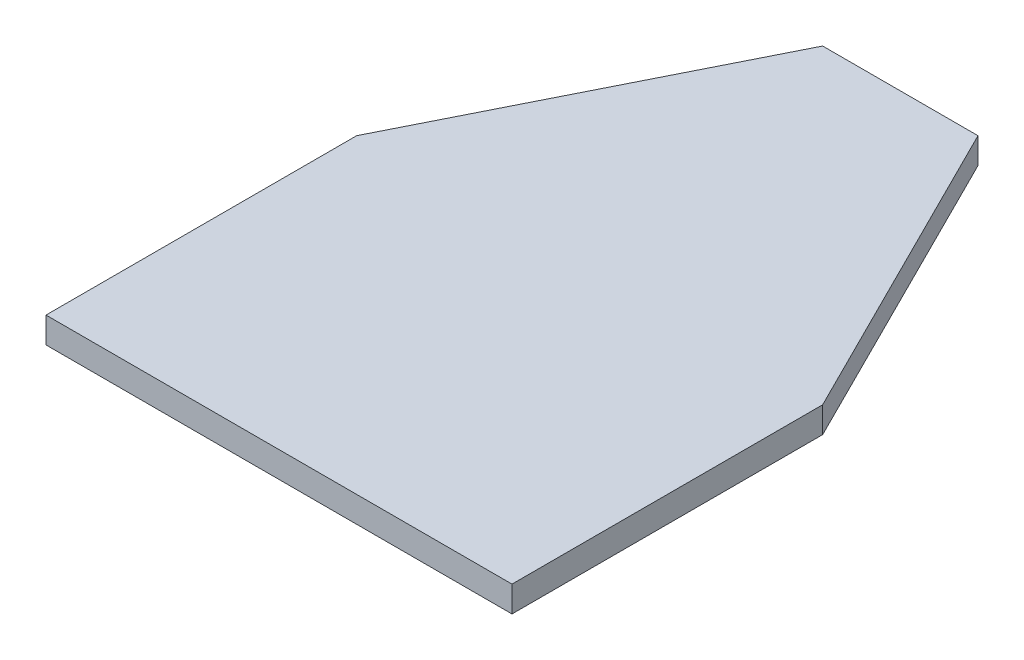
from build123d import *

# Parameters (mm, degrees)
EXTRUDE1_DEPTH = 6.35


with BuildPart() as part:
    # Sketch1 → Extrude1 (new body)
    with BuildSketch(Plane(origin=(0, 0, 0), x_dir=(1, 0, 0), z_dir=(0, 1, 0))):
        Polygon((0, 0), (114.3, 0), (114.3, 76.2), (76.2, 152.4), (38.1, 152.4), (0, 76.2), align=None)
    extrude(amount=EXTRUDE1_DEPTH)


solid = part.part
